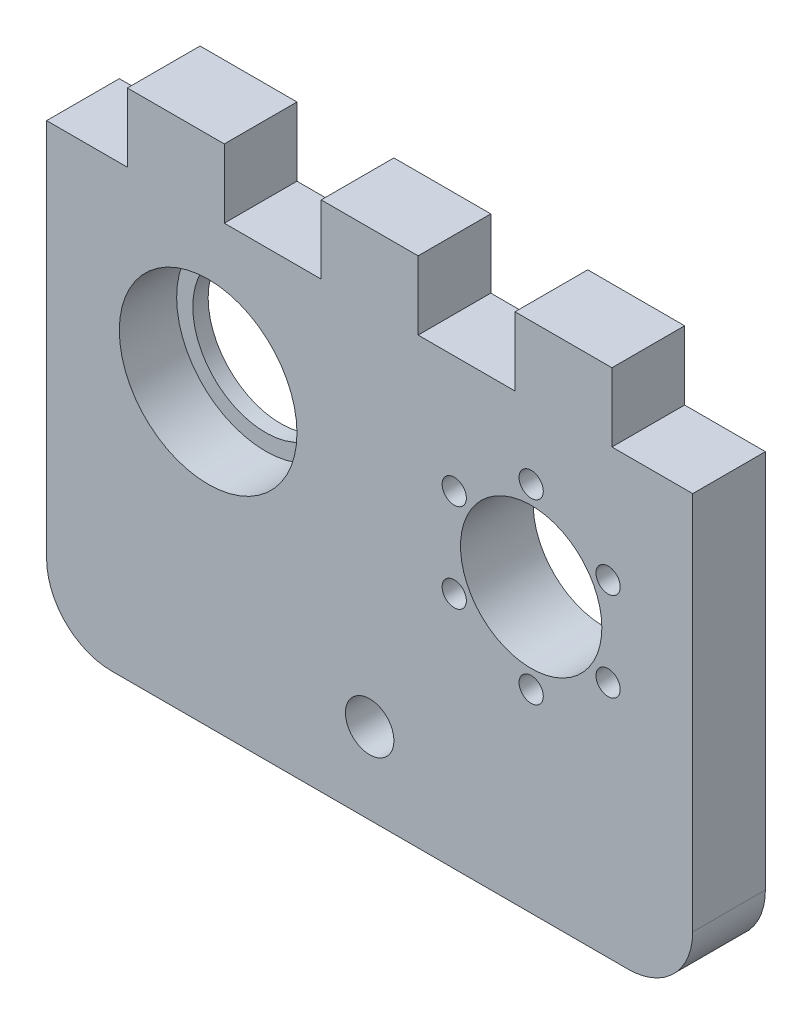
from build123d import *

# Parameters (mm, degrees)
ESQUISSE1_W             = 80
ESQUISSE1_H             = 55
BOSS_EXTRU_1_DEPTH      = 9
ESQUISSE2_R             = 11
ESQUISSE2_R_2           = 8.75
ESQUISSE2_R_3           = 1.5
ENL_V_MAT_EXTRU_1_DEPTH = 98.49871794
ESQUISSE3_R             = 3
ENL_V_MAT_EXTRU_2_DEPTH = 98.49871794
CONG_1_R                = 8
BOSS_EXTRU_2_START      = 1.9
ESQUISSE4_R             = 11
ESQUISSE4_R_2           = 9
BOSS_EXTRU_2_DEPTH      = 1.9
ESQUISSE5_W             = 12
ESQUISSE5_H             = 8.5
BOSS_EXTRU_3_DEPTH      = 9


with BuildPart() as part:
    # Esquisse1 → Boss.-Extru.1 (new body)
    with BuildSketch(Plane.XY):
        with Locations((40, 27.5)):
            Rectangle(ESQUISSE1_W, ESQUISSE1_H)
    extrude(amount=BOSS_EXTRU_1_DEPTH)

    # Esquisse2 → Enlèv. mat.-Extru.1 (cut, through all)
    with BuildSketch(Plane.XY.offset(9)):
        with Locations((20, 37)):
            Circle(ESQUISSE2_R)
        with Locations((60, 35)):
            Circle(ESQUISSE2_R_2)
        with Locations((60, 46)):
            Circle(ESQUISSE2_R_3)
        with Locations((69.526279442, 40.5)):
            Circle(ESQUISSE2_R_3)
        with Locations((69.526279442, 29.5)):
            Circle(ESQUISSE2_R_3)
        with Locations((60, 24)):
            Circle(ESQUISSE2_R_3)
        with Locations((50.473720558, 29.5)):
            Circle(ESQUISSE2_R_3)
        with Locations((50.473720558, 40.5)):
            Circle(ESQUISSE2_R_3)
    extrude(amount=-ENL_V_MAT_EXTRU_1_DEPTH, mode=Mode.SUBTRACT)

    # Esquisse3 → Enlèv. mat.-Extru.2 (cut, through all)
    with BuildSketch(Plane.XY.offset(9)):
        with Locations((40, 10)):
            Circle(ESQUISSE3_R)
    extrude(amount=-ENL_V_MAT_EXTRU_2_DEPTH, mode=Mode.SUBTRACT)

    # Congé1
    cong_1_edges = [part.edges().sort_by_distance(p)[0] for p in [
        (80, 0, 4.5),
        (0, 0, 4.5),
    ]]
    fillet(cong_1_edges, radius=CONG_1_R)

    # Esquisse4 → Boss.-Extru.2 (add)
    with BuildSketch(Plane.XY.offset(BOSS_EXTRU_2_START)):
        with Locations((20, 37)):
            Circle(ESQUISSE4_R)
        with Locations(Location((20, 37, 0), (0, 0, 180))):
            Circle(ESQUISSE4_R_2, mode=Mode.SUBTRACT)
    extrude(amount=-BOSS_EXTRU_2_DEPTH)

    # Esquisse5 → Boss.-Extru.3 (add)
    with BuildSketch(Plane.XY.offset(9)):
        with Locations((40, 59.25)):
            Rectangle(ESQUISSE5_W, ESQUISSE5_H)
        with Locations((16, 59.25)):
            Rectangle(ESQUISSE5_W, ESQUISSE5_H)
        with Locations((64, 59.25)):
            Rectangle(ESQUISSE5_W, ESQUISSE5_H)
    extrude(amount=-BOSS_EXTRU_3_DEPTH)


solid = part.part
